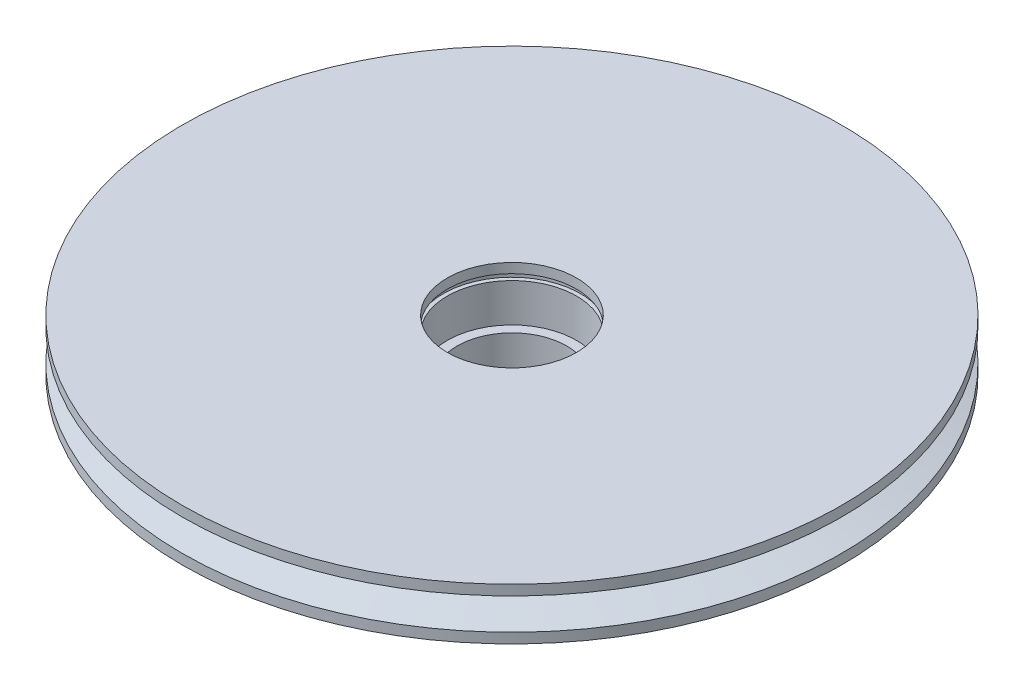
from build123d import *


with BuildPart() as part:
    # Sketch1 → Revolve1 (revolve)
    with BuildSketch(Plane.XY, mode=Mode.PRIVATE) as revolve1_sk:
        Polygon((17, 30.111461363), (17, 16.75), (20, 16.75), (20, 4.85), (21.25, 4.85), (21.25, 3), (20, 3), (20, 0), (39.5, 0), (39.5, 3.138538637), (28.5, 6.501576133), (28.5, 9.498423867), (39.5, 12.861461363), (39.5, 15.138538637), (28.5, 18.501576133), (28.5, 21.498423867), (39.5, 24.861461363), (39.5, 30.861461363), (102, 30.861461363), (102, 34), (91, 37.363037496), (91, 40.35988523), (102, 43.722922726), (102, 46.861461363), (20, 46.861461363), (20, 43.861461363), (21.25, 43.861461363), (21.25, 42.011461363), (20, 42.011461363), (20, 30.111461363), align=None)
    revolve(revolve1_sk.sketch.rotate(Axis((0, 42.105322255, 0), (0, -1, 0)), 90), axis=Axis((0, 42.105322255, 0), (0, -1, 0)))


solid = part.part
